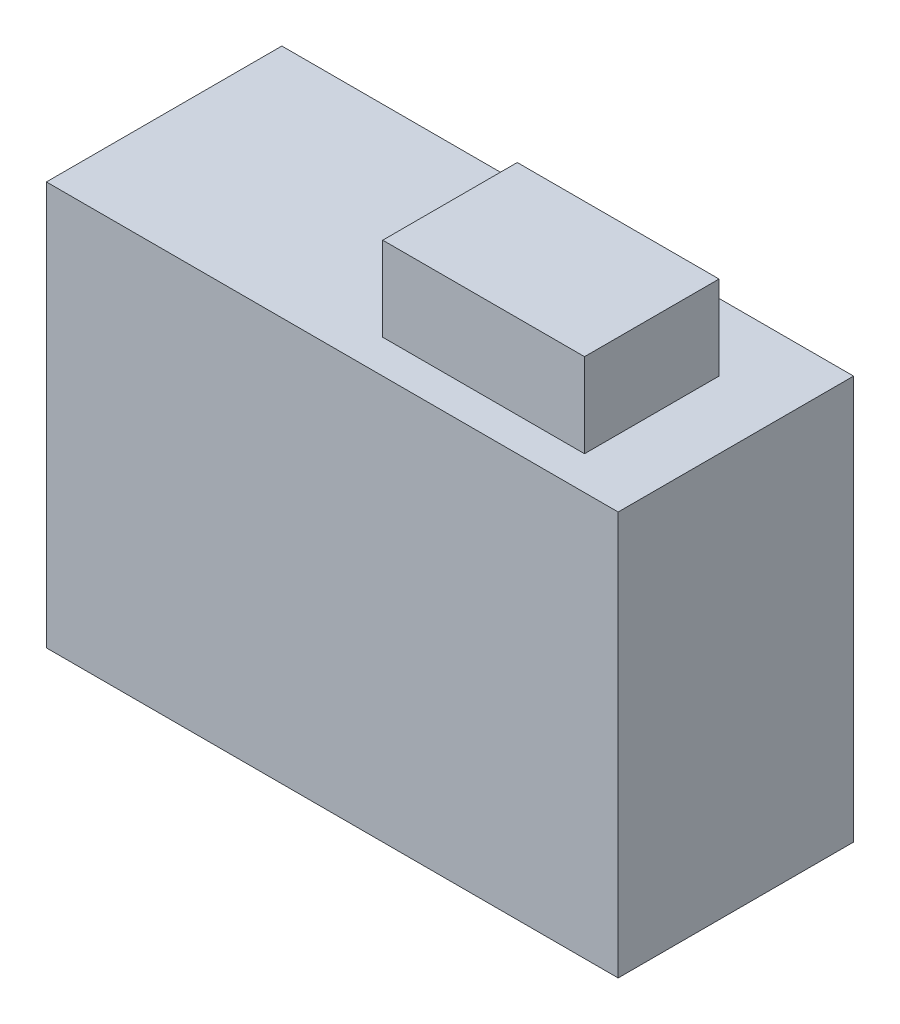
from build123d import *

# Parameters (mm, degrees)
SKETCH_1_W      = 170
SKETCH_1_H      = 120
EXTRUDE_1_DEPTH = 70
SKETCH_2_W      = 60
SKETCH_2_H      = 40
EXTRUDE_2_DEPTH = 25


with BuildPart() as part:
    # 草图1 → 凸台-拉伸1 (new body)
    with BuildSketch(Plane.XY):
        with Locations((35.297814337, -28.048594931)):
            Rectangle(SKETCH_1_W, SKETCH_1_H)
    extrude(amount=EXTRUDE_1_DEPTH)

    # 草图2 → 凸台-拉伸2 (add)
    with BuildSketch(Plane(origin=(0, 31.951405069, 0), x_dir=(1, 0, 0), z_dir=(0, 1, 0))):
        with Locations((70.297814337, -40)):
            Rectangle(SKETCH_2_W, SKETCH_2_H)
    extrude(amount=EXTRUDE_2_DEPTH)


solid = part.part
